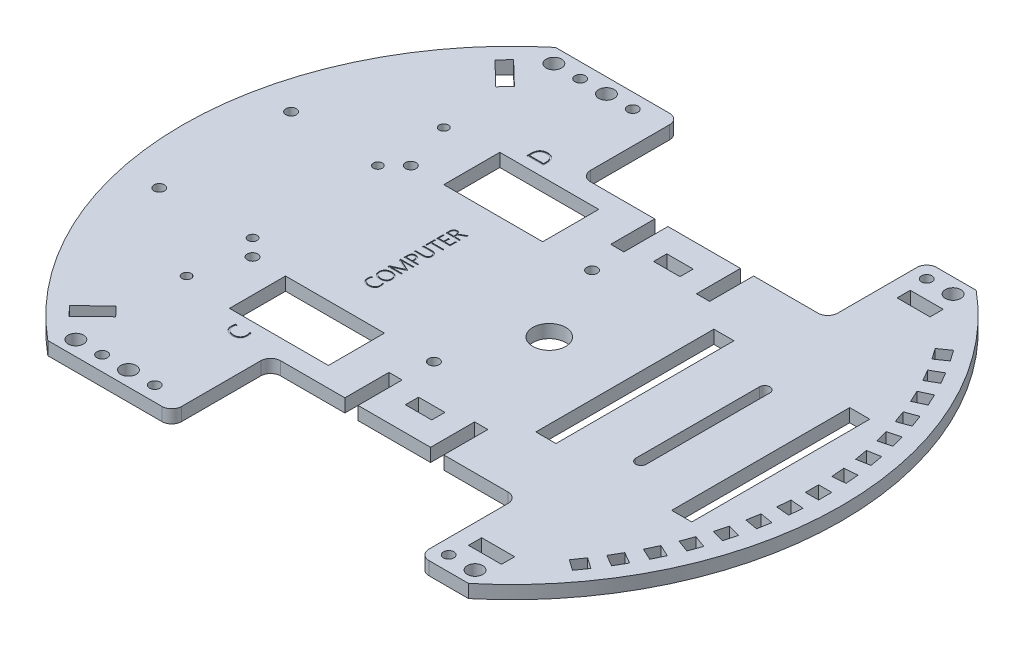
from build123d import *

# Parameters (mm, degrees)
BASIS_DEPTH         = 4
SKETCH2_W           = 4
SKETCH2_H           = 4
MODU_BRACKET_DEPTH  = 4
SKETCH3_W           = 75
SKETCH3_H           = 30
SKETCH3_W_2         = 8
SKETCH3_H_2         = 4
SKETCH3_R           = 5
CUT_EXTRUDE2_DEPTH  = 127.273512662
SKETCH4_W           = 6.1
SKETCH4_H           = 54
CUT_EXTRUDE3_DEPTH  = 4
SKETCH5_W           = 4
SKETCH5_H           = 14
CUT_EXTRUDE4_DEPTH  = 4
SKETCH6_W           = 10
SKETCH6_H           = 4
CUT_EXTRUDE5_DEPTH  = 4
SKETCH9_R           = 1.6
SKETCH9_R_2         = 1.375
CUT_EXTRUDE7_DEPTH  = 4
SKETCH10_W          = 30
SKETCH10_H          = 17
CUT_EXTRUDE8_DEPTH  = 4
SKETCH11_R          = 1.6
CUT_EXTRUDE9_DEPTH  = 4
CUT_EXTRUDE15_DEPTH = 0.2
SKETCH21_R          = 2.35
SKETCH21_R_2        = 1.6
CUT_EXTRUDE16_DEPTH = 4
FILLET1_R           = 3


with BuildPart() as part:
    # Sketch1 → Basis (new body)
    with BuildSketch(Plane(origin=(0, 0, 0), x_dir=(1, 0, 0), z_dir=(0, 1, 0))):
        with BuildLine():
            Line((63.804388564, 77), (-63.804388564, 77))
            ThreePointArc((-63.804388564, 77), (-100, 0), (-63.804388564, -77))
            Line((-63.804388564, -77), (63.804388564, -77))
            ThreePointArc((63.804388564, -77), (90.499831095, -42.541515862), (100, 0))
            ThreePointArc((100, 0), (90.499831095, 42.541515862), (63.804388564, 77))
        make_face()
    extrude(amount=BASIS_DEPTH)

    # Sketch2 → Modu bracket (cut)
    with BuildSketch(Plane(origin=(0, 4, 0), x_dir=(1, 0, 0), z_dir=(0, 1, 0))):
        Polygon((90.817009036, -6.191182133), (94.801787829, -6.539805104), (94.453164858, -10.524583897), (90.468386065, -10.175960926), align=None)
        with Locations((93, 0)):
            Rectangle(SKETCH2_W, SKETCH2_H)
        Polygon((89.920805845, -14.335245632), (93.860036857, -15.029838343), (93.165444147, -18.969069355), (89.226213135, -18.274476644), align=None)
        Polygon((88.318211075, -22.370209256), (92.18191438, -23.405485436), (91.1466382, -27.269188741), (87.282934895, -26.233912561), align=None)
        Polygon((86.021421439, -30.23492208), (89.780191922, -31.603002653), (88.412111349, -35.361773136), (84.653340866, -33.993692563), align=None)
        Polygon((83.047916894, -37.86952889), (86.673148042, -39.560001937), (84.982674995, -43.185233085), (81.357443847, -41.494760038), align=None)
        Polygon((79.420327603, -45.21592572), (82.884429218, -47.21592572), (80.884429218, -50.680027335), (77.420327603, -48.680027335), align=None)
        Polygon((75.166261713, -52.218202052), (78.442869891, -54.512507797), (76.148564145, -57.789115975), (72.871955968, -55.494810229), align=None)
        Polygon((90.468386065, 10.175960926), (94.453164858, 10.524583897), (94.801787829, 6.539805104), (90.817009036, 6.191182133), align=None)
        Polygon((89.226213135, 18.274476644), (93.165444147, 18.969069355), (93.860036857, 15.029838343), (89.920805845, 14.335245632), align=None)
        Polygon((87.282934895, 26.233912561), (91.1466382, 27.269188741), (92.18191438, 23.405485436), (88.318211075, 22.370209256), align=None)
        Polygon((84.653340866, 33.993692563), (88.412111349, 35.361773136), (89.780191922, 31.603002653), (86.021421439, 30.23492208), align=None)
        Polygon((81.357443847, 41.494760038), (84.982674995, 43.185233085), (86.673148042, 39.560001937), (83.047916894, 37.86952889), align=None)
        Polygon((77.420327603, 48.680027335), (80.884429218, 50.680027335), (82.884429218, 47.21592572), (79.420327603, 45.21592572), align=None)
        Polygon((72.871955968, 55.494810229), (76.148564145, 57.789115975), (78.44286989, 54.512507797), (75.166261713, 52.218202052), align=None)
    extrude(amount=-MODU_BRACKET_DEPTH, mode=Mode.SUBTRACT)

    # Sketch3 → Cut-Extrude2 (cut, through all)
    with BuildSketch(Plane(origin=(0, 4, 0), x_dir=(1, 0, 0), z_dir=(0, 1, 0))):
        with Locations((11.304388564, -62)):
            Rectangle(SKETCH3_W, SKETCH3_H)
        with Locations((11.304388564, 62)):
            Rectangle(SKETCH3_W, SKETCH3_H)
        with Locations((11.304388564, -37.65)):
            Rectangle(SKETCH3_W_2, SKETCH3_H_2)
        with Locations((11.304388564, 37.65)):
            Rectangle(SKETCH3_W_2, SKETCH3_H_2)
        with Locations(Location((11.304388564, 0, 0), (0, 0, 270))):
            Circle(SKETCH3_R)
    extrude(amount=-CUT_EXTRUDE2_DEPTH, mode=Mode.SUBTRACT)

    # Sketch4 → Cut-Extrude3 (cut)
    with BuildSketch(Plane(origin=(0, 4, 0), x_dir=(1, 0, 0), z_dir=(0, 1, 0))):
        with BuildLine():
            Line((56.282145861, -18.75), (56.282145861, 18.75))
            ThreePointArc((56.282145861, 18.75), (57.882145861, 20.35), (59.482145861, 18.75))
            Line((59.482145861, 18.75), (59.482145861, -18.75))
            ThreePointArc((59.482145861, -18.75), (57.882145861, -20.35), (56.282145861, -18.75))
        make_face()
        with Locations((78.482145861, 0)):
            Rectangle(SKETCH4_W, SKETCH4_H)
        with Locations((37.282145861, 0)):
            Rectangle(SKETCH4_W, SKETCH4_H)
    extrude(amount=-CUT_EXTRUDE3_DEPTH, mode=Mode.SUBTRACT)

    # Sketch5 → Cut-Extrude4 (cut)
    with BuildSketch(Plane(origin=(0, 4, 0), x_dir=(1, 0, 0), z_dir=(0, 1, 0))):
        with Locations((-1.695611436, -40.64)):
            Rectangle(SKETCH5_W, SKETCH5_H)
        with Locations((-1.695611436, 40.64)):
            Rectangle(SKETCH5_W, SKETCH5_H)
        with Locations((24.304388564, 40.64)):
            Rectangle(SKETCH5_W, SKETCH5_H)
        with Locations((24.304388564, -40.64)):
            Rectangle(SKETCH5_W, SKETCH5_H)
    extrude(amount=-CUT_EXTRUDE4_DEPTH, mode=Mode.SUBTRACT)

    # Sketch6 → Cut-Extrude5 (cut)
    with BuildSketch(Plane(origin=(0, 4, 0), x_dir=(1, 0, 0), z_dir=(0, 1, 0))):
        Polygon((-62.518054096, 57.592655881), (-59.739420614, 60.470015082), (-66.932818617, 67.416598787), (-69.711452099, 64.539239585), align=None)
        Polygon((-59.739420614, -60.470015082), (-62.518054096, -57.592655881), (-69.711452099, -64.539239585), (-66.932818617, -67.416598787), align=None)
        with Locations((58.804388564, -65)):
            Rectangle(SKETCH6_W, SKETCH6_H)
        with Locations((58.804388564, 65)):
            Rectangle(SKETCH6_W, SKETCH6_H)
    extrude(amount=-CUT_EXTRUDE5_DEPTH, mode=Mode.SUBTRACT)

    # Sketch9 → Cut-Extrude7 (cut)
    with BuildSketch(Plane(origin=(0, 4, 0), x_dir=(1, 0, 0), z_dir=(0, 1, 0))):
        with Locations(Location((-54.695611436, -24, 0), (0, 0, 270))):
            Circle(SKETCH9_R)
        with Locations(Location((-54.695611436, 24, 0), (0, 0, 270))):
            Circle(SKETCH9_R)
        with Locations(Location((0.304388564, 24, 0), (0, 0, 270))):
            Circle(SKETCH9_R)
        with Locations(Location((0.304388564, -24, 0), (0, 0, 270))):
            Circle(SKETCH9_R)
        with Locations(Location((-59.695611436, 39, 0), (0, 0, 270))):
            Circle(SKETCH9_R_2)
        with Locations(Location((-59.695611436, -19, 0), (0, 0, 270))):
            Circle(SKETCH9_R_2)
        with Locations(Location((-59.695611436, 19, 0), (0, 0, 270))):
            Circle(SKETCH9_R_2)
        with Locations(Location((-59.695611436, -39, 0), (0, 0, 270))):
            Circle(SKETCH9_R_2)
    extrude(amount=-CUT_EXTRUDE7_DEPTH, mode=Mode.SUBTRACT)

    # Sketch10 → Cut-Extrude8 (cut)
    with BuildSketch(Plane(origin=(0, 4, 0), x_dir=(1, 0, 0), z_dir=(0, 1, 0))):
        with Locations((-29.695611436, 32.5)):
            Rectangle(SKETCH10_W, SKETCH10_H)
        with Locations((-29.695611436, -32.5)):
            Rectangle(SKETCH10_W, SKETCH10_H)
    extrude(amount=-CUT_EXTRUDE8_DEPTH, mode=Mode.SUBTRACT)

    # Sketch11 → Cut-Extrude9 (cut)
    with BuildSketch(Plane(origin=(0, 4, 0), x_dir=(1, 0, 0), z_dir=(0, 1, 0))):
        with Locations(Location((-87, -20, 0), (0, 0, 270))):
            Circle(SKETCH11_R)
        with Locations(Location((-87, 20, 0), (0, 0, 270))):
            Circle(SKETCH11_R)
    extrude(amount=-CUT_EXTRUDE9_DEPTH, mode=Mode.SUBTRACT)

    # Sketch19 → Cut-Extrude15 (cut)
    # profile 1 of 10: a face of its own
    with BuildSketch(Plane(origin=(0, 4, 0), x_dir=(1, 0, 0), z_dir=(0, 1, 0))):
        with BuildLine():
            Line((-27.620116509, 13.789473684), (-28.764030983, 13.189967105))
            add(Edge.make_bspline(
                [(-28.764030983, 13.189967105), (-28.791190547, 13.175211367), (-28.843592501, 13.146741487), (-28.919163135, 13.104737241), (-28.986003035, 13.060475386), (-29.065302202, 13.007064011), (-29.14879643, 12.937773157), (-29.231285032, 12.850032048), (-29.29100747, 12.755802777), (-29.331930074, 12.655323047), (-29.352858252, 12.545282642), (-29.355550789, 12.469106119), (-29.356958614, 12.429276316)],
                knots=[0, 0, 0, 0, 0.903061509, 1.742376591, 2.524256031, 3.243953603, 4.534835044, 5.685456425, 6.747387141, 7.774944003, 8.836602936, 10, 10, 10, 10], degree=3))
            Line((-29.356958614, 12.429276316), (-29.356958614, 11.990953947))
            Line((-29.356958614, 11.990953947), (-27.620116509, 11.990953947))
            Line((-27.620116509, 11.990953947), (-27.620116509, 11.621710526))
            Line((-27.620116509, 11.621710526), (-31.620116509, 11.621710526))
            Line((-31.620116509, 11.621710526), (-31.620116509, 12.768092105))
            add(Edge.make_bspline(
                [(-31.620116509, 12.768092105), (-31.619412802, 12.805142521), (-31.61800612, 12.879204758), (-31.603996193, 12.988790924), (-31.583783484, 13.096991137), (-31.554174196, 13.202303344), (-31.516727853, 13.304310481), (-31.470328532, 13.400701886), (-31.416868601, 13.491838282), (-31.354912712, 13.576650612), (-31.285461998, 13.655539408), (-31.205410049, 13.724282057), (-31.118704721, 13.786903261), (-31.023010732, 13.840130596), (-30.919277559, 13.884676653), (-30.806154605, 13.914164388), (-30.685789781, 13.934075928), (-30.602658625, 13.935796469), (-30.560083614, 13.936677632)],
                knots=[0, 0, 0, 0, 1.004805807, 2.00856497, 2.99321005, 3.989362039, 4.973079627, 5.937859508, 6.888195761, 7.835879596, 8.784030328, 9.732822668, 10.692572006, 11.681589819, 12.698300189, 13.746622881, 14.845949456, 16, 16, 16, 16], degree=3))
            add(Edge.make_bspline(
                [(-30.560083614, 13.936677632), (-30.52524678, 13.935808295), (-30.456751093, 13.934099017), (-30.356128023, 13.923003872), (-30.260059639, 13.901725085), (-30.167960111, 13.874289553), (-30.08053004, 13.8382729), (-29.99723593, 13.797206657), (-29.920325282, 13.746706883), (-29.847989459, 13.691207927), (-29.780916751, 13.628915963), (-29.718934824, 13.560651523), (-29.663248034, 13.485279984), (-29.611988695, 13.404691872), (-29.566789545, 13.317962075), (-29.527344121, 13.225925663), (-29.494177184, 13.128272064), (-29.47736302, 13.060716966), (-29.46880072, 13.026315789)],
                knots=[0, 0, 0, 0, 1.081046277, 2.125537793, 3.134839472, 4.130392803, 5.103344118, 6.065716514, 7.007073963, 7.952993041, 8.891926538, 9.84341236, 10.809648441, 11.796003091, 12.804193144, 13.840618968, 14.900375405, 16, 16, 16, 16], degree=3))
            Line((-29.46880072, 13.026315789), (-29.45810993, 13.026315789))
            add(Edge.make_bspline(
                [(-29.45810993, 13.026315789), (-29.445922114, 13.052193734), (-29.421698402, 13.103627058), (-29.372456595, 13.174713523), (-29.313138461, 13.240964793), (-29.242988271, 13.304555691), (-29.162417276, 13.3669573), (-29.069235382, 13.427894442), (-28.965005313, 13.491486215), (-28.889782191, 13.532152562), (-28.850379667, 13.553453947)],
                knots=[0, 0, 0, 0, 0.835845044, 1.66127139, 2.519262614, 3.433316564, 4.428101089, 5.498200815, 6.689535865, 8, 8, 8, 8], degree=3))
            Line((-28.850379667, 13.553453947), (-27.620116509, 14.222039474))
            Line((-27.620116509, 14.222039474), (-27.620116509, 13.789473684))
        make_face()
        with BuildLine():
            Line((-31.304327035, 11.990953947), (-29.672748088, 11.990953947))
            Line((-29.672748088, 11.990953947), (-29.672748088, 12.651315789))
            add(Edge.make_bspline(
                [(-29.672748088, 12.651315789), (-29.673695142, 12.683953649), (-29.675554534, 12.748032928), (-29.685509082, 12.84213515), (-29.706167779, 12.931545043), (-29.732150438, 13.01688928), (-29.764474449, 13.097810772), (-29.805546361, 13.171870215), (-29.8511839, 13.241087224), (-29.905382327, 13.302649763), (-29.964524058, 13.358576827), (-30.028974034, 13.408865386), (-30.100576985, 13.45038428), (-30.17681889, 13.4867416), (-30.258483814, 13.515992112), (-30.345845988, 13.535112857), (-30.437717221, 13.547970319), (-30.500827263, 13.549424438), (-30.532945456, 13.550164474)],
                knots=[0, 0, 0, 0, 1.118280553, 2.195567075, 3.234318192, 4.25595527, 5.249774383, 6.211909628, 7.151985671, 8.083820438, 9.01366643, 9.937615825, 10.876378126, 11.84235388, 12.828246894, 13.839520117, 14.900480674, 16, 16, 16, 16], degree=3))
            add(Edge.make_bspline(
                [(-30.532945456, 13.550164474), (-30.562317905, 13.54966745), (-30.619352905, 13.548702336), (-30.702391246, 13.537331564), (-30.780821481, 13.520674107), (-30.854250942, 13.495618246), (-30.923270113, 13.464591854), (-30.986768722, 13.425183376), (-31.046585396, 13.380355883), (-31.099916405, 13.326861544), (-31.148766241, 13.268224065), (-31.189717006, 13.202212387), (-31.225680587, 13.131179661), (-31.253980376, 13.053167718), (-31.27754426, 12.969188652), (-31.292198524, 12.878409844), (-31.302663751, 12.782041892), (-31.303762829, 12.71576591), (-31.304327035, 12.681743421)],
                knots=[0, 0, 0, 0, 1.067701683, 2.073247865, 3.043414083, 3.979944331, 4.890200411, 5.789743022, 6.693201142, 7.602801576, 8.531013581, 9.463287335, 10.422061572, 11.422253792, 12.476978517, 13.59009175, 14.762883996, 16, 16, 16, 16], degree=3))
            Line((-31.304327035, 12.681743421), (-31.304327035, 11.990953947))
        make_face(mode=Mode.SUBTRACT)
    # profile 2 of 10: a face of its own
    with BuildSketch(Plane(origin=(0, 4, 0), x_dir=(1, 0, 0), z_dir=(0, 1, 0))):
        Polygon((-27.620116509, 8.779605263), (-31.620116509, 8.779605263), (-31.620116509, 10.719572368), (-31.304327035, 10.719572368), (-31.304327035, 9.148848684), (-29.830642825, 9.148848684), (-29.830642825, 10.602796053), (-29.514853351, 10.602796053), (-29.514853351, 9.148848684), (-27.935905983, 9.148848684), (-27.935905983, 10.808388158), (-27.620116509, 10.808388158), align=None)
    # profile 3 of 10: a face of its own
    with BuildSketch(Plane(origin=(0, 4, 0), x_dir=(1, 0, 0), z_dir=(0, 1, 0))):
        Polygon((-31.304327035, 6.970394737), (-27.620116509, 6.970394737), (-27.620116509, 6.601151316), (-31.304327035, 6.601151316), (-31.304327035, 5.454769737), (-31.620116509, 5.454769737), (-31.620116509, 8.119243421), (-31.304327035, 8.119243421), align=None)
    # profile 4 of 10: a face of its own
    with BuildSketch(Plane(origin=(0, 4, 0), x_dir=(1, 0, 0), z_dir=(0, 1, 0))):
        with BuildLine():
            add(Edge.make_bspline(
                [(-29.236892825, 4.854440789), (-29.169420931, 4.853402494), (-29.038628789, 4.85138979), (-28.8490037, 4.834023572), (-28.672588988, 4.805378693), (-28.508606268, 4.766454599), (-28.357803796, 4.714955689), (-28.220231134, 4.651110597), (-28.095143059, 4.577171434), (-27.982746797, 4.491525667), (-27.885576229, 4.392048983), (-27.798894196, 4.283510022), (-27.727135741, 4.162025828), (-27.668862365, 4.029332005), (-27.622335106, 3.8856292), (-27.591297482, 3.729960106), (-27.570869525, 3.5633166), (-27.568635715, 3.448255807), (-27.56748493, 3.388980263)],
                knots=[0, 0, 0, 0, 1.272094822, 2.465915786, 3.586784003, 4.639895922, 5.640312585, 6.586187648, 7.494834008, 8.375709258, 9.241964425, 10.110606718, 10.989112876, 11.893928501, 12.838771959, 13.8312382, 14.882725103, 16, 16, 16, 16], degree=3))
            add(Edge.make_bspline(
                [(-27.56748493, 3.388980263), (-27.5687221, 3.33245504), (-27.57111973, 3.222909421), (-27.590317717, 3.064109202), (-27.621313036, 2.916217065), (-27.664373714, 2.778796458), (-27.721901342, 2.652696673), (-27.790839288, 2.536952894), (-27.87280915, 2.432061503), (-27.968774519, 2.339646786), (-28.075946263, 2.256783751), (-28.196591568, 2.185777814), (-28.329445125, 2.126186178), (-28.474390198, 2.076398601), (-28.632313936, 2.039157082), (-28.802494325, 2.012506912), (-28.985191317, 1.995782274), (-29.111033044, 1.993683053), (-29.176037562, 1.992598684)],
                knots=[0, 0, 0, 0, 1.111652278, 2.154376957, 3.141109948, 4.080749178, 4.980876659, 5.861260347, 6.725325793, 7.590937817, 8.475341693, 9.384405097, 10.337639061, 11.335215598, 12.394594385, 13.524896759, 14.721466261, 16, 16, 16, 16], degree=3))
            Line((-29.176037562, 1.992598684), (-31.620116509, 1.992598684))
            Line((-31.620116509, 1.992598684), (-31.620116509, 2.361842105))
            Line((-31.620116509, 2.361842105), (-29.195774404, 2.361842105))
            add(Edge.make_bspline(
                [(-29.195774404, 2.361842105), (-29.142568754, 2.362573228), (-29.039569146, 2.363988593), (-28.890153836, 2.376506741), (-28.751069933, 2.396649339), (-28.622290757, 2.425176486), (-28.503932589, 2.46220281), (-28.395699864, 2.507109372), (-28.297877493, 2.560970495), (-28.209702978, 2.622526529), (-28.132831264, 2.694118943), (-28.065147552, 2.773803127), (-28.008270816, 2.863196203), (-27.962217081, 2.961687282), (-27.926714215, 3.069127594), (-27.901821763, 3.185208036), (-27.885581807, 3.310398901), (-27.884061094, 3.396875885), (-27.883274404, 3.441611842)],
                knots=[0, 0, 0, 0, 1.309829472, 2.535669114, 3.68874031, 4.767830525, 5.779663952, 6.738609548, 7.64788441, 8.524300816, 9.379246836, 10.227022699, 11.092033486, 11.979708973, 12.897486227, 13.871889042, 14.899093424, 16, 16, 16, 16], degree=3))
            add(Edge.make_bspline(
                [(-27.883274404, 3.441611842), (-27.884136617, 3.48387762), (-27.885805163, 3.5656699), (-27.901081268, 3.684286145), (-27.925010708, 3.795075528), (-27.960936426, 3.897364111), (-28.004982507, 3.992369897), (-28.060762457, 4.078102945), (-28.125542444, 4.156553709), (-28.200552466, 4.226739416), (-28.286518587, 4.287607156), (-28.381246218, 4.341615308), (-28.486825434, 4.385387274), (-28.601536922, 4.423039563), (-28.726814828, 4.449905923), (-28.861321373, 4.470676047), (-29.005852319, 4.483022486), (-29.105564066, 4.484456083), (-29.157123088, 4.485197368)],
                knots=[0, 0, 0, 0, 1.076453379, 2.083141037, 3.042254347, 3.958949106, 4.840013232, 5.704108844, 6.557266996, 7.427018169, 8.312858942, 9.235521398, 10.19942948, 11.219906867, 12.307810762, 13.459622977, 14.686420011, 16, 16, 16, 16], degree=3))
            Line((-29.157123088, 4.485197368), (-31.620116509, 4.485197368))
            Line((-31.620116509, 4.485197368), (-31.620116509, 4.854440789))
            Line((-31.620116509, 4.854440789), (-29.236892825, 4.854440789))
        make_face()
    # profile 5 of 10: a face of its own
    with BuildSketch(Plane(origin=(0, 4, 0), x_dir=(1, 0, 0), z_dir=(0, 1, 0))):
        with BuildLine():
            Line((-29.199063877, -0.745888158), (-27.620116509, -0.745888158))
            Line((-27.620116509, -0.745888158), (-27.620116509, -1.115131579))
            Line((-27.620116509, -1.115131579), (-31.620116509, -1.115131579))
            Line((-31.620116509, -1.115131579), (-31.620116509, -0.087993421))
            add(Edge.make_bspline(
                [(-31.620116509, -0.087993421), (-31.619249864, -0.037238436), (-31.617564184, 0.061483199), (-31.602211081, 0.204902168), (-31.579035634, 0.339542926), (-31.54514859, 0.464967068), (-31.502539098, 0.58155004), (-31.450715695, 0.688710937), (-31.390399521, 0.786792155), (-31.321150725, 0.87508684), (-31.24338185, 0.95378411), (-31.157131037, 1.022733508), (-31.062332241, 1.081099261), (-30.959283945, 1.128993584), (-30.84853776, 1.166967499), (-30.73002458, 1.193921256), (-30.603808767, 1.20949635), (-30.51736414, 1.211805836), (-30.472912562, 1.212993421)],
                knots=[0, 0, 0, 0, 1.236019132, 2.404134908, 3.509688229, 4.560971219, 5.564512457, 6.529176288, 7.455738066, 8.364122578, 9.256560592, 10.145092731, 11.047592091, 11.961726316, 12.907790279, 13.894302119, 14.917207481, 16, 16, 16, 16], degree=3))
            add(Edge.make_bspline(
                [(-30.472912562, 1.212993421), (-30.427617592, 1.211997653), (-30.338570172, 1.210040028), (-30.2077284, 1.191278957), (-30.08223177, 1.161198752), (-29.962919221, 1.117973154), (-29.849543048, 1.064768514), (-29.744358205, 0.999667547), (-29.647094982, 0.924051426), (-29.558274495, 0.838162366), (-29.476877343, 0.742643341), (-29.406582971, 0.635765877), (-29.344283681, 0.51976628), (-29.291919207, 0.393942771), (-29.249689054, 0.258901919), (-29.220646476, 0.114756947), (-29.201898522, -0.037881179), (-29.200024799, -0.142759937), (-29.199063877, -0.196546053)],
                knots=[0, 0, 0, 0, 1.016771988, 1.998917831, 2.962065238, 3.910459402, 4.84404989, 5.770119108, 6.682684896, 7.60578183, 8.540711207, 9.495240556, 10.473073674, 11.494142412, 12.551539424, 13.645496299, 14.792514225, 16, 16, 16, 16], degree=3))
            Line((-29.199063877, -0.196546053), (-29.199063877, -0.745888158))
        make_face()
        with BuildLine():
            Line((-31.304327035, -0.745888158), (-29.514853351, -0.745888158))
            Line((-29.514853351, -0.745888158), (-29.514853351, -0.21875))
            add(Edge.make_bspline(
                [(-29.514853351, -0.21875), (-29.515786323, -0.177344287), (-29.517599845, -0.096859335), (-29.52749163, 0.020446297), (-29.547849006, 0.129646217), (-29.573419649, 0.231833529), (-29.608403875, 0.325424853), (-29.649087462, 0.41249154), (-29.700007194, 0.490340323), (-29.756501561, 0.561954406), (-29.821182758, 0.624232285), (-29.891240705, 0.679436728), (-29.968881322, 0.724460555), (-30.052015982, 0.762959185), (-30.142365467, 0.790956285), (-30.238193723, 0.812908064), (-30.340476404, 0.824990505), (-30.410657532, 0.826519596), (-30.446596772, 0.827302632)],
                knots=[0, 0, 0, 0, 1.245486358, 2.420992219, 3.535117186, 4.582850288, 5.584387862, 6.535673548, 7.466376358, 8.375320672, 9.273093409, 10.160243496, 11.050948542, 11.965854676, 12.909609425, 13.88960899, 14.919284271, 16, 16, 16, 16], degree=3))
            add(Edge.make_bspline(
                [(-30.446596772, 0.827302632), (-30.481171962, 0.82650802), (-30.548328549, 0.824964619), (-30.645708628, 0.813202697), (-30.736767348, 0.794788225), (-30.82106435, 0.767459309), (-30.898843592, 0.732819341), (-30.970398255, 0.691097492), (-31.033689979, 0.640089567), (-31.091794518, 0.582980756), (-31.141302912, 0.516700137), (-31.185622348, 0.443654546), (-31.222441303, 0.362403508), (-31.252810278, 0.273745888), (-31.275389433, 0.177217374), (-31.292901256, 0.073733918), (-31.302529229, -0.037920409), (-31.303714359, -0.114840117), (-31.304327035, -0.154605263)],
                knots=[0, 0, 0, 0, 1.110849669, 2.157641729, 3.147624309, 4.092032564, 4.999009, 5.87981024, 6.745189988, 7.604811272, 8.491058283, 9.396021736, 10.346001286, 11.351693919, 12.402924693, 13.528211502, 14.722160645, 16, 16, 16, 16], degree=3))
            Line((-31.304327035, -0.154605263), (-31.304327035, -0.745888158))
        make_face(mode=Mode.SUBTRACT)
    # profile 6 of 10: a face of its own
    with BuildSketch(Plane(origin=(0, 4, 0), x_dir=(1, 0, 0), z_dir=(0, 1, 0))):
        with BuildLine():
            Line((-27.620116509, -2.487664474), (-30.381629667, -2.487664474))
            add(Edge.make_bspline(
                [(-30.381629667, -2.487664474), (-30.400544836, -2.487430305), (-30.441395185, -2.486924581), (-30.506639106, -2.485223564), (-30.580101736, -2.482665693), (-30.661543465, -2.479610475), (-30.750881399, -2.474362902), (-30.848469177, -2.468619009), (-30.954010253, -2.462086048), (-31.027190579, -2.457262863), (-31.065017825, -2.454769737)],
                knots=[0, 0, 0, 0, 0.663469798, 1.432869696, 2.289045709, 3.241657293, 4.291223725, 5.427728572, 6.670381085, 8, 8, 8, 8], degree=3))
            Line((-31.065017825, -2.454769737), (-31.065017825, -2.465460526))
            add(Edge.make_bspline(
                [(-31.065017825, -2.465460526), (-31.025776089, -2.477948058), (-30.952912142, -2.501134873), (-30.852309258, -2.53509602), (-30.767924741, -2.56427535), (-30.718682034, -2.586326987), (-30.696596772, -2.596217105)],
                knots=[0, 0, 0, 0, 1.263216973, 2.345537769, 3.257976802, 4, 4, 4, 4], degree=3))
            Line((-30.696596772, -2.596217105), (-27.620116509, -3.983552632))
            Line((-27.620116509, -3.983552632), (-27.620116509, -4.142269737))
            Line((-27.620116509, -4.142269737), (-30.677682298, -5.532894737))
            add(Edge.make_bspline(
                [(-30.677682298, -5.532894737), (-30.703079312, -5.543291408), (-30.758246421, -5.565874942), (-30.8494963, -5.596521383), (-30.955192105, -5.627708413), (-31.030691088, -5.647426283), (-31.070774404, -5.657894737)],
                knots=[0, 0, 0, 0, 0.797442207, 1.732195089, 2.795995166, 4, 4, 4, 4], degree=3))
            Line((-31.070774404, -5.657894737), (-31.070774404, -5.668585526))
            add(Edge.make_bspline(
                [(-31.070774404, -5.668585526), (-31.025011953, -5.665264152), (-30.927535017, -5.658189414), (-30.771999315, -5.653557679), (-30.598216443, -5.648710252), (-30.476206877, -5.648800981), (-30.412057298, -5.648848684)],
                knots=[0, 0, 0, 0, 0.835188276, 1.77900421, 2.832255964, 4, 4, 4, 4], degree=3))
            Line((-30.412057298, -5.648848684), (-27.620116509, -5.648848684))
            Line((-27.620116509, -5.648848684), (-27.620116509, -6.009868421))
            Line((-27.620116509, -6.009868421), (-31.620116509, -6.009868421))
            Line((-31.620116509, -6.009868421), (-31.620116509, -5.574013158))
            Line((-31.620116509, -5.574013158), (-28.613537562, -4.222861842))
            add(Edge.make_bspline(
                [(-28.613537562, -4.222861842), (-28.581524834, -4.208739712), (-28.517233222, -4.180378038), (-28.418585763, -4.139948293), (-28.316418785, -4.10008824), (-28.24527823, -4.078475981), (-28.208932298, -4.067434211)],
                knots=[0, 0, 0, 0, 0.967910463, 1.943868249, 2.949515866, 4, 4, 4, 4], degree=3))
            Line((-28.208932298, -4.067434211), (-28.208932298, -4.050164474))
            add(Edge.make_bspline(
                [(-28.208932298, -4.050164474), (-28.244522758, -4.037696078), (-28.312347461, -4.013935068), (-28.412999472, -3.981062246), (-28.511357802, -3.943789375), (-28.576381626, -3.91532077), (-28.610248088, -3.900493421)],
                knots=[0, 0, 0, 0, 1.05602382, 2.012463505, 2.964828222, 4, 4, 4, 4], degree=3))
            Line((-28.610248088, -3.900493421), (-31.620116509, -2.537828947))
            Line((-31.620116509, -2.537828947), (-31.620116509, -2.124177632))
            Line((-31.620116509, -2.124177632), (-27.620116509, -2.124177632))
            Line((-27.620116509, -2.124177632), (-27.620116509, -2.487664474))
        make_face()
    # profile 7 of 10: a face of its own
    with BuildSketch(Plane(origin=(0, 4, 0), x_dir=(1, 0, 0), z_dir=(0, 1, 0))):
        with BuildLine():
            add(Edge.make_bspline(
                [(-27.56748493, -8.704769737), (-27.569391499, -8.774765058), (-27.573124245, -8.911804256), (-27.602059682, -9.112158924), (-27.651685546, -9.301481244), (-27.71989135, -9.479652608), (-27.805960439, -9.645002095), (-27.905880183, -9.798472538), (-28.020613045, -9.938798401), (-28.149633495, -10.065794373), (-28.29121236, -10.179845704), (-28.446245737, -10.278383132), (-28.612223119, -10.364608025), (-28.789771158, -10.43551106), (-28.976198244, -10.492432526), (-29.170527852, -10.532611082), (-29.371690985, -10.556878902), (-29.508206919, -10.560064235), (-29.577353351, -10.561677632)],
                knots=[0, 0, 0, 0, 1.094690685, 2.143222323, 3.158357395, 4.150628525, 5.121089247, 6.069014929, 7.010663822, 7.950661171, 8.896275617, 9.849067524, 10.819528245, 11.81808022, 12.835468004, 13.864858446, 14.918533406, 16, 16, 16, 16], degree=3))
            add(Edge.make_bspline(
                [(-29.577353351, -10.561677632), (-29.653349927, -10.560102533), (-29.8021647, -10.557018211), (-30.020540101, -10.53268601), (-30.229177695, -10.49284664), (-30.427159702, -10.435963654), (-30.613839901, -10.365153129), (-30.786387979, -10.277143526), (-30.946184337, -10.176044406), (-31.09179119, -10.05963199), (-31.222264974, -9.928065171), (-31.337916386, -9.782794408), (-31.437889503, -9.623469765), (-31.522850616, -9.451238168), (-31.590926615, -9.265374461), (-31.637681695, -9.066284242), (-31.667352958, -8.855057129), (-31.670918518, -8.71008122), (-31.672748088, -8.635690789)],
                knots=[0, 0, 0, 0, 1.135098782, 2.222724729, 3.278053572, 4.304641296, 5.296355567, 6.256031204, 7.193259783, 8.116780063, 9.034726822, 9.955692206, 10.885077429, 11.839258921, 12.819953991, 13.83506688, 14.889123666, 16, 16, 16, 16], degree=3))
            add(Edge.make_bspline(
                [(-31.672748088, -8.635690789), (-31.67124688, -8.567047757), (-31.668308481, -8.432688938), (-31.638408186, -8.237090879), (-31.591893154, -8.051930803), (-31.525926338, -7.87790644), (-31.442277248, -7.715926195), (-31.345320997, -7.565103225), (-31.23246003, -7.427717568), (-31.105447371, -7.303308659), (-30.964908698, -7.192091828), (-30.812573203, -7.093791971), (-30.647211282, -7.010508542), (-30.470796051, -6.940796723), (-30.28379346, -6.886138459), (-30.088700577, -6.845307413), (-29.885189434, -6.822476929), (-29.747089552, -6.819134153), (-29.67685993, -6.817434211)],
                knots=[0, 0, 0, 0, 1.085622768, 2.124949721, 3.123492609, 4.102458151, 5.062878371, 6.003878161, 6.93486425, 7.870538747, 8.812308255, 9.766594808, 10.734744107, 11.73772532, 12.764517951, 13.814438789, 14.88854983, 16, 16, 16, 16], degree=3))
            add(Edge.make_bspline(
                [(-29.67685993, -6.817434211), (-29.602772503, -6.818634133), (-29.457211611, -6.820991642), (-29.243160491, -6.846186405), (-29.03728826, -6.883959814), (-28.840374042, -6.938479092), (-28.65392569, -7.00708156), (-28.478889044, -7.090251653), (-28.317448849, -7.189064503), (-28.169350201, -7.302523076), (-28.034577321, -7.429119226), (-27.915435239, -7.570746299), (-27.812250991, -7.726611023), (-27.73925172, -7.866718376), (-27.688699546, -7.985058754), (-27.657183534, -8.078545929), (-27.628706107, -8.174339801), (-27.60687946, -8.274221774), (-27.58846151, -8.377008132), (-27.576523151, -8.48360186), (-27.568835742, -8.593086926), (-27.567939322, -8.667201387), (-27.56748493, -8.704769737)],
                knots=[0, 0, 0, 0, 1.39256119, 2.735989868, 4.047258665, 5.325361257, 6.573039493, 7.778881373, 8.963537039, 10.125477781, 11.281399994, 12.433776708, 13.597534063, 14.789546312, 15.399401698, 16.015607094, 16.643664706, 17.277701547, 17.937028807, 18.606474621, 19.293627067, 20, 20, 20, 20], degree=3))
        make_face()
        with BuildLine():
            add(Edge.make_bspline(
                [(-31.356958614, -8.674342105), (-31.355143898, -8.732816249), (-31.351598761, -8.847048325), (-31.326201452, -9.013385769), (-31.282161915, -9.16916344), (-31.222118814, -9.314735807), (-31.146010157, -9.4488428), (-31.057130067, -9.572058472), (-30.95764267, -9.685571411), (-30.84506499, -9.787029068), (-30.720886817, -9.876733382), (-30.586930864, -9.955757965), (-30.442538013, -10.022747843), (-30.288763101, -10.077358824), (-30.127581477, -10.120618048), (-29.960445192, -10.151971034), (-29.788317234, -10.171088609), (-29.671699337, -10.174341542), (-29.612715193, -10.175986842)],
                knots=[0, 0, 0, 0, 1.086986669, 2.123481199, 3.118956744, 4.090024357, 5.043928893, 5.978815167, 6.910361557, 7.844900483, 8.789886759, 9.753974943, 10.732131513, 11.744488731, 12.784185878, 13.831722769, 14.903307476, 16, 16, 16, 16], degree=3))
            add(Edge.make_bspline(
                [(-29.612715193, -10.175986842), (-29.556491029, -10.175066484), (-29.444917714, -10.17324009), (-29.279319033, -10.157780292), (-29.117666488, -10.129109891), (-28.960013065, -10.091440285), (-28.808723271, -10.040341357), (-28.665590066, -9.977994658), (-28.531116248, -9.904572672), (-28.40673307, -9.818979681), (-28.292764964, -9.721573857), (-28.189728847, -9.612829459), (-28.10107298, -9.490502832), (-28.022810085, -9.357950393), (-27.959962532, -9.212319258), (-27.914816762, -9.054607159), (-27.88830887, -8.884940294), (-27.884985812, -8.768187865), (-27.883274404, -8.708059211)],
                knots=[0, 0, 0, 0, 1.057301632, 2.098148519, 3.123689704, 4.142744375, 5.143734472, 6.122601695, 7.075507161, 8.020739524, 8.95680323, 9.890478868, 10.830862553, 11.79198838, 12.780312955, 13.80499856, 14.869552578, 16, 16, 16, 16], degree=3))
            add(Edge.make_bspline(
                [(-27.883274404, -8.708059211), (-27.88470807, -8.647652107), (-27.887490488, -8.530415705), (-27.913188039, -8.360482028), (-27.952401035, -8.201363677), (-28.010797478, -8.054436056), (-28.082914641, -7.918933161), (-28.166357189, -7.794100988), (-28.264043768, -7.681900566), (-28.373726667, -7.581420324), (-28.495289608, -7.492507203), (-28.627550834, -7.414525108), (-28.771502244, -7.349880637), (-28.925443597, -7.296652344), (-29.088598956, -7.254897919), (-29.25955776, -7.224683031), (-29.438233351, -7.206068761), (-29.559763529, -7.204119434), (-29.621761246, -7.203125)],
                knots=[0, 0, 0, 0, 1.115134252, 2.16422109, 3.167586413, 4.136091443, 5.076129482, 5.998824188, 6.903404032, 7.8172756, 8.740914609, 9.680557075, 10.648174838, 11.650632594, 12.685942574, 13.755697576, 14.855085787, 16, 16, 16, 16], degree=3))
            add(Edge.make_bspline(
                [(-29.621761246, -7.203125), (-29.679920195, -7.203891193), (-29.794835079, -7.205405096), (-29.964781771, -7.222941672), (-30.130241965, -7.24873211), (-30.290408158, -7.28537938), (-30.443296115, -7.333474932), (-30.587052244, -7.3936427), (-30.721252017, -7.465276249), (-30.844760229, -7.549315458), (-30.957970378, -7.644918559), (-31.057455298, -7.754581883), (-31.146388244, -7.875416783), (-31.222402527, -8.008861932), (-31.282882135, -8.156033992), (-31.326380167, -8.316441529), (-31.35181394, -8.490967506), (-31.355202724, -8.611755901), (-31.356958614, -8.674342105)],
                knots=[0, 0, 0, 0, 1.084120281, 2.142087468, 3.182484255, 4.205468637, 5.202936944, 6.167483597, 7.10744408, 8.034683938, 8.948411588, 9.863753536, 10.7890328, 11.741351995, 12.720057716, 13.7480744, 14.833170384, 16, 16, 16, 16], degree=3))
        make_face(mode=Mode.SUBTRACT)
    # profile 8 of 10: a face of its own
    with BuildSketch(Plane(origin=(0, 4, 0), x_dir=(1, 0, 0), z_dir=(0, 1, 0))):
        with BuildLine():
            add(Edge.make_bspline(
                [(-27.783767825, -11.176809211), (-27.76618498, -11.215494683), (-27.730762995, -11.293429522), (-27.688133196, -11.415348176), (-27.650597759, -11.540931297), (-27.620516233, -11.670624823), (-27.596603274, -11.804288767), (-27.57917578, -11.942047536), (-27.569400813, -12.084010924), (-27.568127952, -12.180084265), (-27.56748493, -12.228618421)],
                knots=[0, 0, 0, 0, 0.941704103, 1.897134834, 2.860573505, 3.846822653, 4.847054991, 5.870017597, 6.923979344, 8, 8, 8, 8], degree=3))
            add(Edge.make_bspline(
                [(-27.56748493, -12.228618421), (-27.569038371, -12.297531549), (-27.572078324, -12.432388709), (-27.601385213, -12.629804555), (-27.646464646, -12.817829133), (-27.711991158, -12.995117561), (-27.793709955, -13.160615701), (-27.889310143, -13.314763856), (-27.999970307, -13.455864471), (-28.124819311, -13.58412833), (-28.263322833, -13.698277649), (-28.41424119, -13.799444458), (-28.577637028, -13.886646555), (-28.752725462, -13.95967529), (-28.93826613, -14.017398819), (-29.132677407, -14.058017314), (-29.335446882, -14.08353078), (-29.473383754, -14.086487524), (-29.543636246, -14.087993421)],
                knots=[0, 0, 0, 0, 1.08501409, 2.123280781, 3.13719125, 4.126390959, 5.094012464, 6.04068709, 6.978901718, 7.913421573, 8.85508874, 9.801329844, 10.77124231, 11.76817965, 12.785808208, 13.82762552, 14.893590094, 16, 16, 16, 16], degree=3))
            add(Edge.make_bspline(
                [(-29.543636246, -14.087993421), (-29.617730313, -14.08625829), (-29.763653005, -14.082841078), (-29.978520941, -14.055699424), (-30.185495356, -14.012406561), (-30.384143644, -13.951707241), (-30.572068523, -13.873696996), (-30.74832138, -13.780385245), (-30.911875106, -13.672426067), (-31.062306691, -13.549499923), (-31.198167342, -13.411915542), (-31.31922517, -13.260505057), (-31.42385821, -13.094711533), (-31.513647877, -12.916324989), (-31.586263643, -12.724859792), (-31.63478534, -12.520788768), (-31.668040694, -12.306184226), (-31.67115477, -12.159124644), (-31.672748088, -12.083881579)],
                knots=[0, 0, 0, 0, 1.08378236, 2.134427858, 3.16330646, 4.174419904, 5.168761633, 6.135810083, 7.087998613, 8.031361748, 8.972924254, 9.911843585, 10.862036619, 11.835980097, 12.829731186, 13.850132463, 14.900019834, 16, 16, 16, 16], degree=3))
            add(Edge.make_bspline(
                [(-31.672748088, -12.083881579), (-31.670897229, -12.001550067), (-31.667282377, -11.840751159), (-31.63780903, -11.606292038), (-31.590884835, -11.384633195), (-31.542077068, -11.245189362), (-31.518142825, -11.176809211)],
                knots=[0, 0, 0, 0, 1.06765162, 2.0851945, 3.06102201, 4, 4, 4, 4], degree=3))
            Line((-31.518142825, -11.176809211), (-31.12505072, -11.176809211))
            add(Edge.make_bspline(
                [(-31.12505072, -11.176809211), (-31.143641976, -11.212482124), (-31.180572647, -11.283344718), (-31.22688425, -11.393325323), (-31.268105931, -11.504352152), (-31.299451025, -11.618201294), (-31.325509063, -11.733367871), (-31.34304242, -11.850477842), (-31.355577105, -11.969300416), (-31.356495618, -12.049308421), (-31.356958614, -12.089638158)],
                knots=[0, 0, 0, 0, 1.014056328, 2.014376018, 3.007214784, 3.998584336, 4.989857471, 5.983225584, 6.983401938, 8, 8, 8, 8], degree=3))
            add(Edge.make_bspline(
                [(-31.356958614, -12.089638158), (-31.35554338, -12.152233237), (-31.3527811, -12.274407508), (-31.326484414, -12.452129231), (-31.28491744, -12.619316652), (-31.226403282, -12.775507863), (-31.152151694, -12.919798504), (-31.063992082, -13.052107185), (-30.964637401, -13.174336132), (-30.850016422, -13.282550903), (-30.725128985, -13.380226142), (-30.58772004, -13.464142291), (-30.440822993, -13.537594991), (-30.282907181, -13.597588542), (-30.116013416, -13.644129814), (-29.940814732, -13.677660755), (-29.758248418, -13.698871201), (-29.633881428, -13.701147552), (-29.570774404, -13.702302632)],
                knots=[0, 0, 0, 0, 1.107570837, 2.161777918, 3.172866549, 4.15268833, 5.107714033, 6.039155523, 6.963158462, 7.889935617, 8.823801425, 9.765215496, 10.735374581, 11.727712143, 12.750991723, 13.798913268, 14.883111716, 16, 16, 16, 16], degree=3))
            add(Edge.make_bspline(
                [(-29.570774404, -13.702302632), (-29.513692808, -13.701402748), (-29.400849584, -13.699623791), (-29.234731739, -13.679282876), (-29.073282832, -13.650727482), (-28.918080473, -13.607420052), (-28.769499251, -13.553833815), (-28.62951585, -13.488059638), (-28.500264742, -13.4093193), (-28.379871175, -13.320549276), (-28.271104014, -13.218852955), (-28.173380435, -13.105794927), (-28.08850461, -12.980461384), (-28.014911004, -12.844477085), (-27.95492315, -12.696740349), (-27.913734191, -12.536618281), (-27.887387574, -12.365457523), (-27.884670531, -12.24736062), (-27.883274404, -12.186677632)],
                knots=[0, 0, 0, 0, 1.072677432, 2.120550009, 3.142600351, 4.15293896, 5.145932548, 6.109654905, 7.055472448, 7.987354245, 8.917295511, 9.849234321, 10.791337022, 11.757605836, 12.752043041, 13.780945426, 14.859759584, 16, 16, 16, 16], degree=3))
            add(Edge.make_bspline(
                [(-27.883274404, -12.186677632), (-27.884017508, -12.139496775), (-27.885484713, -12.046341603), (-27.898509837, -11.909102763), (-27.917472681, -11.77593387), (-27.946984245, -11.64761779), (-27.982523518, -11.522758335), (-28.028310953, -11.40302658), (-28.080512882, -11.286907751), (-28.122265443, -11.213510014), (-28.143142825, -11.176809211)],
                knots=[0, 0, 0, 0, 1.072450921, 2.117476394, 3.132004095, 4.128451721, 5.108706732, 6.081083926, 7.040491356, 8, 8, 8, 8], degree=3))
            Line((-28.143142825, -11.176809211), (-27.783767825, -11.176809211))
        make_face()
    # profile 9 of 10: a face of its own
    with BuildSketch(Plane(origin=(0, 4, 0), x_dir=(1, 0, 0), z_dir=(0, 1, 0))):
        with BuildLine():
            Line((-34.695611436, 44.211348684), (-39.695611436, 44.211348684))
            Line((-39.695611436, 44.211348684), (-39.695611436, 45.518914474))
            add(Edge.make_bspline(
                [(-39.695611436, 45.518914474), (-39.694028016, 45.622124784), (-39.690954496, 45.822462535), (-39.661764298, 46.113189207), (-39.614232473, 46.384594504), (-39.546458385, 46.636471679), (-39.460163293, 46.86898819), (-39.355552588, 47.082872544), (-39.229170512, 47.275935731), (-39.08455638, 47.450444329), (-38.92016785, 47.603988067), (-38.737634354, 47.738155888), (-38.535925941, 47.850106556), (-38.316113537, 47.941628567), (-38.078662671, 48.014081651), (-37.822229823, 48.063005852), (-37.547972865, 48.094798521), (-37.358808964, 48.098313402), (-37.26140091, 48.100123355)],
                knots=[0, 0, 0, 0, 1.219485978, 2.367099538, 3.44902777, 4.472649525, 5.445245922, 6.376134433, 7.280329046, 8.165932322, 9.048363345, 9.932047934, 10.836723055, 11.767831754, 12.741430902, 13.765156789, 14.849189898, 16, 16, 16, 16], degree=3))
            add(Edge.make_bspline(
                [(-37.26140091, 48.100123355), (-37.167075162, 48.097995168), (-36.981904986, 48.093817339), (-36.710898489, 48.05973204), (-36.453389719, 48.001591681), (-36.209290545, 47.923106141), (-35.980319263, 47.821964994), (-35.767392152, 47.700941181), (-35.573018259, 47.557520975), (-35.395166391, 47.395613637), (-35.23569714, 47.214200992), (-35.094541819, 47.014279103), (-34.974601908, 46.795272239), (-34.873521667, 46.558839555), (-34.793590841, 46.305822001), (-34.735848748, 46.036427453), (-34.701864672, 45.751425086), (-34.697725489, 45.556013643), (-34.695611436, 45.456208882)],
                knots=[0, 0, 0, 0, 1.088117128, 2.136074667, 3.14511766, 4.130340795, 5.089761744, 6.028363337, 6.950398193, 7.871118262, 8.798334626, 9.731801164, 10.689142592, 11.673945198, 12.694256998, 13.745773381, 14.848672595, 16, 16, 16, 16], degree=3))
            Line((-34.695611436, 45.456208882), (-34.695611436, 44.211348684))
        make_face()
        with BuildLine():
            Line((-39.300874594, 44.672902961), (-35.090348278, 44.672902961))
            Line((-35.090348278, 44.672902961), (-35.090348278, 45.435649671))
            add(Edge.make_bspline(
                [(-35.090348278, 45.435649671), (-35.092264721, 45.51896896), (-35.096004515, 45.681560275), (-35.121049529, 45.919105243), (-35.166835477, 46.142403539), (-35.227758287, 46.352413504), (-35.307486009, 46.546932998), (-35.401581379, 46.727993393), (-35.515780934, 46.891595265), (-35.644837138, 47.041004206), (-35.790233697, 47.174081113), (-35.95236912, 47.290428092), (-36.13112557, 47.388776403), (-36.325290758, 47.471295509), (-36.53501234, 47.536127023), (-36.760194069, 47.581787244), (-37.000267616, 47.609973318), (-37.16537801, 47.613246548), (-37.250093344, 47.614925987)],
                knots=[0, 0, 0, 0, 1.146087312, 2.236503031, 3.280075387, 4.277767161, 5.239647988, 6.167318118, 7.078571647, 7.977306687, 8.878029249, 9.783155626, 10.715662226, 11.678627877, 12.6804192, 13.729553805, 14.835072687, 16, 16, 16, 16], degree=3))
            add(Edge.make_bspline(
                [(-37.250093344, 47.614925987), (-37.333072324, 47.613412785), (-37.493937254, 47.610479259), (-37.727195394, 47.586051633), (-37.943984094, 47.543522557), (-38.145656207, 47.487091443), (-38.33089935, 47.411384917), (-38.500616913, 47.320004545), (-38.654029659, 47.21139378), (-38.791208965, 47.085742043), (-38.911680903, 46.943173838), (-39.016458736, 46.784058473), (-39.104958946, 46.608463737), (-39.176514853, 46.41587341), (-39.233126583, 46.207410348), (-39.272584547, 45.982396502), (-39.296287369, 45.740778976), (-39.299312341, 45.574137828), (-39.300874594, 45.488075658)],
                knots=[0, 0, 0, 0, 1.174949677, 2.27778406, 3.316051809, 4.300538128, 5.23859307, 6.144038748, 7.024592755, 7.893517868, 8.771447346, 9.661060064, 10.585537062, 11.549906156, 12.565798079, 13.640440787, 14.781400693, 16, 16, 16, 16], degree=3))
            Line((-39.300874594, 45.488075658), (-39.300874594, 44.672902961))
        make_face(mode=Mode.SUBTRACT)
    # profile 10 of 10: a face of its own
    with BuildSketch(Plane(origin=(0, 4, 0), x_dir=(1, 0, 0), z_dir=(0, 1, 0))):
        with BuildLine():
            add(Edge.make_bspline(
                [(-34.900175581, -44.214432566), (-34.878197024, -44.262789407), (-34.833919544, -44.360207956), (-34.780632295, -44.512606272), (-34.733712998, -44.669585174), (-34.696111091, -44.831702081), (-34.666219892, -44.998782011), (-34.644435525, -45.170980473), (-34.632216816, -45.348434708), (-34.63062574, -45.468526383), (-34.629821963, -45.529194079)],
                knots=[0, 0, 0, 0, 0.941704103, 1.897134834, 2.860573505, 3.846822653, 4.847054991, 5.870017597, 6.923979344, 8, 8, 8, 8], degree=3))
            add(Edge.make_bspline(
                [(-34.629821963, -45.529194079), (-34.631763764, -45.615335488), (-34.635563705, -45.783906939), (-34.672197317, -46.030676747), (-34.728546607, -46.265707469), (-34.810454747, -46.487318004), (-34.912603244, -46.694190678), (-35.032103479, -46.886875873), (-35.170428683, -47.063251641), (-35.326489939, -47.223581465), (-35.499619342, -47.366268114), (-35.688267288, -47.492726625), (-35.892512085, -47.601729246), (-36.111372627, -47.693015165), (-36.343298463, -47.765169576), (-36.586312559, -47.815942695), (-36.839774403, -47.847834527), (-37.012195492, -47.851530458), (-37.100011107, -47.853412829)],
                knots=[0, 0, 0, 0, 1.08501409, 2.123280781, 3.13719125, 4.126390959, 5.094012464, 6.04068709, 6.978901718, 7.913421573, 8.85508874, 9.801329844, 10.77124231, 11.76817965, 12.785808208, 13.82762552, 14.893590094, 16, 16, 16, 16], degree=3))
            add(Edge.make_bspline(
                [(-37.100011107, -47.853412829), (-37.192628691, -47.851243915), (-37.375032057, -47.846972401), (-37.643616976, -47.813045333), (-37.902334995, -47.758929254), (-38.150645355, -47.683055104), (-38.385551453, -47.585542298), (-38.605867524, -47.468902609), (-38.810309682, -47.333953637), (-38.998349164, -47.180295956), (-39.168174978, -47.00831548), (-39.319497263, -46.819052374), (-39.450288562, -46.611810469), (-39.562525646, -46.388827289), (-39.653295354, -46.149495793), (-39.713947475, -45.894407013), (-39.755516668, -45.626151335), (-39.759409263, -45.442326858), (-39.76140091, -45.348273026)],
                knots=[0, 0, 0, 0, 1.08378236, 2.134427858, 3.16330646, 4.174419904, 5.168761633, 6.135810083, 7.087998613, 8.031361748, 8.972924254, 9.911843585, 10.862036619, 11.835980097, 12.829731186, 13.850132463, 14.900019834, 16, 16, 16, 16], degree=3))
            add(Edge.make_bspline(
                [(-39.76140091, -45.348273026), (-39.759087336, -45.245358637), (-39.754568772, -45.044360002), (-39.717727088, -44.7512861), (-39.659071844, -44.474212546), (-39.598062134, -44.299907755), (-39.568144331, -44.214432566)],
                knots=[0, 0, 0, 0, 1.06765162, 2.0851945, 3.06102201, 4, 4, 4, 4], degree=3))
            Line((-39.568144331, -44.214432566), (-39.076779199, -44.214432566))
            add(Edge.make_bspline(
                [(-39.076779199, -44.214432566), (-39.10001827, -44.259023708), (-39.146181609, -44.34760195), (-39.204071112, -44.485077707), (-39.255598213, -44.623861242), (-39.294779581, -44.766172671), (-39.327352129, -44.910130892), (-39.349268824, -45.056518355), (-39.364937181, -45.205046573), (-39.366085323, -45.305056579), (-39.366664068, -45.35546875)],
                knots=[0, 0, 0, 0, 1.014056328, 2.014376018, 3.007214784, 3.998584336, 4.989857471, 5.983225584, 6.983401938, 8, 8, 8, 8], degree=3))
            add(Edge.make_bspline(
                [(-39.366664068, -45.35546875), (-39.364895025, -45.433712599), (-39.361442175, -45.586430438), (-39.328571317, -45.808582591), (-39.2766126, -46.017566867), (-39.203469903, -46.212805881), (-39.110655417, -46.393169182), (-39.000455902, -46.558555034), (-38.876262552, -46.711341218), (-38.732986327, -46.846609682), (-38.576877031, -46.96870373), (-38.40511585, -47.073598917), (-38.221494541, -47.165414792), (-38.024099776, -47.24040673), (-37.81548257, -47.298583321), (-37.596484215, -47.340496997), (-37.368276322, -47.367010053), (-37.212817585, -47.369855493), (-37.133933805, -47.371299342)],
                knots=[0, 0, 0, 0, 1.107570837, 2.161777918, 3.172866549, 4.15268833, 5.107714033, 6.039155523, 6.963158462, 7.889935617, 8.823801425, 9.765215496, 10.735374581, 11.727712143, 12.750991723, 13.798913268, 14.883111716, 16, 16, 16, 16], degree=3))
            add(Edge.make_bspline(
                [(-37.133933805, -47.371299342), (-37.062581809, -47.370174488), (-36.92152778, -47.367950792), (-36.713880473, -47.342524647), (-36.512069341, -47.306830406), (-36.318066391, -47.252696118), (-36.132339863, -47.185713321), (-35.957360613, -47.1034956), (-35.795796727, -47.005070178), (-35.645304769, -46.894107647), (-35.509345818, -46.766987247), (-35.387191343, -46.625664711), (-35.281096562, -46.468997783), (-35.189104555, -46.299017409), (-35.114119737, -46.114346489), (-35.062633539, -45.914193904), (-35.029700267, -45.700242956), (-35.026303963, -45.552621827), (-35.024558805, -45.476768092)],
                knots=[0, 0, 0, 0, 1.072677432, 2.120550009, 3.142600351, 4.15293896, 5.145932548, 6.109654905, 7.055472448, 7.987354245, 8.917295511, 9.849234321, 10.791337022, 11.757605836, 12.752043041, 13.780945426, 14.859759584, 16, 16, 16, 16], degree=3))
            add(Edge.make_bspline(
                [(-35.024558805, -45.476768092), (-35.025487685, -45.417792021), (-35.027321692, -45.301348057), (-35.043603097, -45.129799506), (-35.067306652, -44.96333839), (-35.104196106, -44.802943291), (-35.148620197, -44.646868972), (-35.205854491, -44.497204278), (-35.271106903, -44.352055741), (-35.323297604, -44.260308571), (-35.349394331, -44.214432566)],
                knots=[0, 0, 0, 0, 1.072450921, 2.117476394, 3.132004095, 4.128451721, 5.108706732, 6.081083926, 7.040491356, 8, 8, 8, 8], degree=3))
            Line((-35.349394331, -44.214432566), (-34.900175581, -44.214432566))
        make_face()
    extrude(amount=-CUT_EXTRUDE15_DEPTH, mode=Mode.SUBTRACT)

    # Sketch21 → Cut-Extrude16 (cut)
    with BuildSketch(Plane(origin=(0, 4, 0), x_dir=(1, 0, 0), z_dir=(0, 1, 0))):
        with Locations(Location((-59.804388564, -72.5, 0), (0, 0, 270))):
            Circle(SKETCH21_R)
        with Locations(Location((-43.844388564, -72.5, 0), (0, 0, 270))):
            Circle(SKETCH21_R)
        with Locations(Location((61.284388564, -72.5, 0), (0, 0, 270))):
            Circle(SKETCH21_R)
        with Locations(Location((61.284388564, 72.5, 0), (0, 0, 270))):
            Circle(SKETCH21_R)
        with Locations(Location((-43.844388564, 72.5, 0), (0, 0, 270))):
            Circle(SKETCH21_R)
        with Locations(Location((-59.804388564, 72.5, 0), (0, 0, 270))):
            Circle(SKETCH21_R)
        with Locations(Location((-51.824388564, -72.5, 0), (0, 0, 270))):
            Circle(SKETCH21_R_2)
        with Locations(Location((-35.864388564, -72.5, 0), (0, 0, 270))):
            Circle(SKETCH21_R_2)
        with Locations(Location((53.304388564, -72.5, 0), (0, 0, 270))):
            Circle(SKETCH21_R_2)
        with Locations(Location((53.304388564, 72.5, 0), (0, 0, 270))):
            Circle(SKETCH21_R_2)
        with Locations(Location((-35.864388564, 72.5, 0), (0, 0, 270))):
            Circle(SKETCH21_R_2)
        with Locations(Location((-51.824388564, 72.5, 0), (0, 0, 270))):
            Circle(SKETCH21_R_2)
    extrude(amount=-CUT_EXTRUDE16_DEPTH, mode=Mode.SUBTRACT)

    # Fillet1
    fillet1_edges = [part.edges().sort_by_distance(p)[0] for p in [
        (48.804388564, 2, 77),
        (-26.195611436, 2, 77),
        (-26.195611436, 2, 47),
        (48.804388564, 2, 47),
        (48.804388564, 2, -77),
        (48.804388564, 2, -47),
        (-26.195611436, 2, -47),
        (-26.195611436, 2, -77),
    ]]
    fillet(fillet1_edges, radius=FILLET1_R)


solid = part.part
